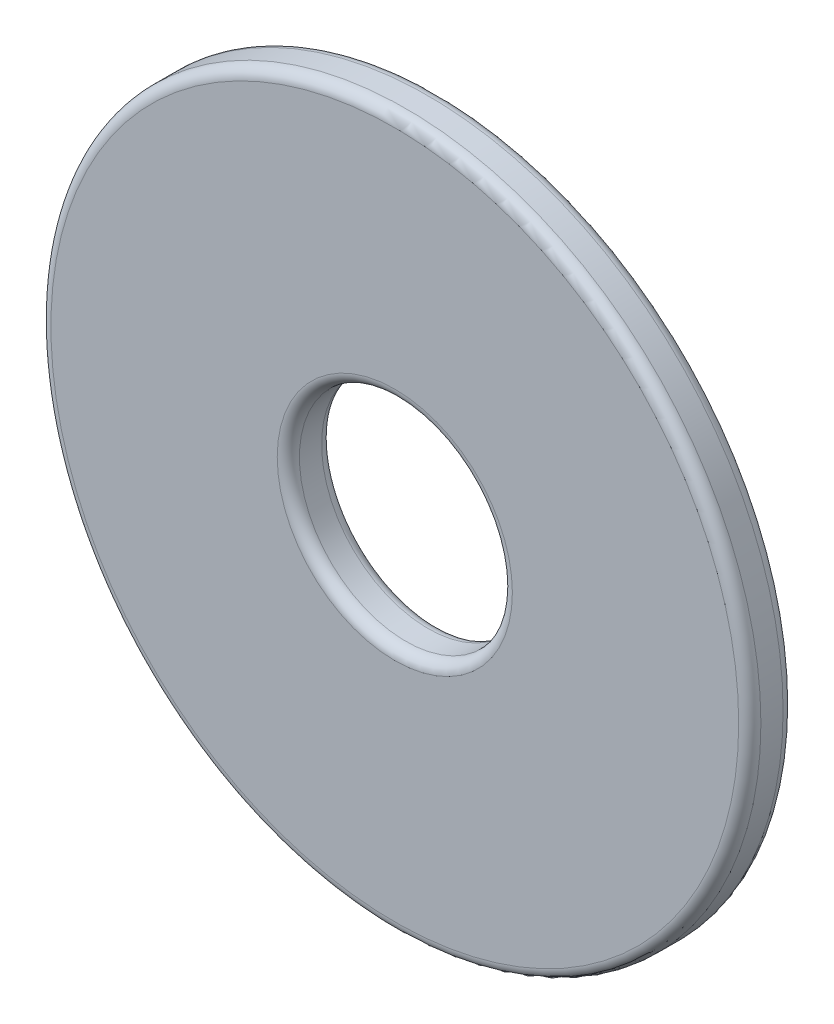
from build123d import *

# Parameters (mm, degrees)
SKETCH1_R           = 12.7
SKETCH1_R_2         = 3.81
BOSS_EXTRUDE1_DEPTH = 1.5875
FILLET1_R           = 0.396875


with BuildPart() as part:
    # Sketch1 → Boss-Extrude1 (new body)
    with BuildSketch(Plane.XY):
        Circle(SKETCH1_R)
        Circle(SKETCH1_R_2, mode=Mode.SUBTRACT)
    extrude(amount=BOSS_EXTRUDE1_DEPTH)

    # Fillet1
    fillet1_edges = [part.edges().sort_by_distance(p)[0] for p in [
        (-12.7, 0, 0),
        (-12.7, 0, 1.5875),
        (-3.81, 0, 0),
        (-3.81, 0, 1.5875),
    ]]
    fillet(fillet1_edges, radius=FILLET1_R)


solid = part.part
